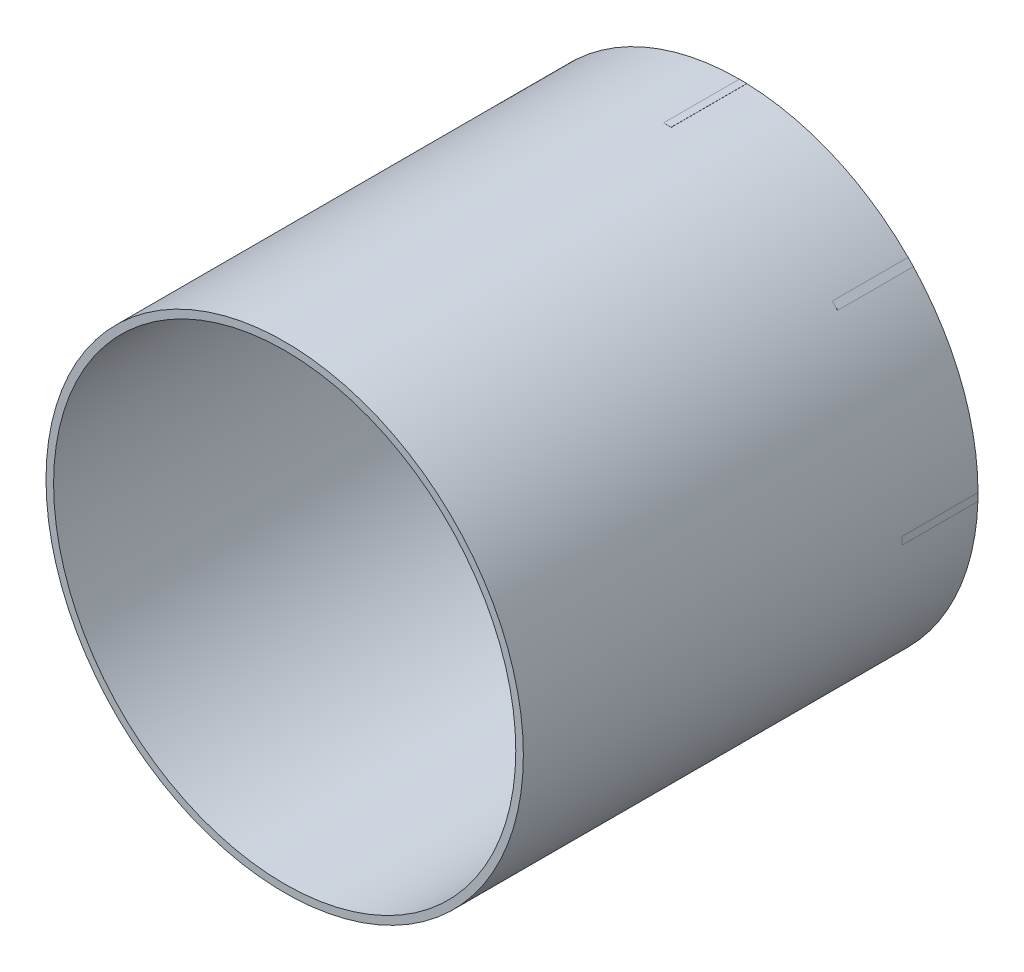
from build123d import *

# Parameters (mm, degrees)
SKETCH_1_R               = 31.5
SKETCH_1_R_2             = 30.5
EXTRUDE_1_DEPTH          = 60
SKETCH_2_W               = 31.5
SKETCH_2_H               = 1
EXTRUDE_1_2_DEPTH        = 10
PATTERN_CIRCULAR_1_COUNT = 8
SKETCH_3_R               = 12
EXTRUDE_2_DEPTH          = 3
SKETCH_4_R               = 1.6
SKETCH_4_R_2             = 5.1
CUT_EXTRUDE_1_DEPTH      = 5
PATTERN_CIRCULAR_3_COUNT = 2


with BuildPart() as part:
    # 草图1 → Extrude 1 (new body)
    with BuildSketch(Plane.XY):
        Circle(SKETCH_1_R)
        Circle(SKETCH_1_R_2, mode=Mode.SUBTRACT)
    extrude(amount=EXTRUDE_1_DEPTH)

    # 草图2 → Extrude 1 2 (add)
    with BuildSketch(Plane.XY):
        with Locations((15.75, -0.5)):
            Rectangle(SKETCH_2_W, SKETCH_2_H)
    extrude_1_2 = extrude(amount=EXTRUDE_1_2_DEPTH)

    # 阵列(圆周)1: Extrude 1 2 ×8 about axis
    pattern_circular_1_axis = Axis((0, 0, 0), (0, 0, 1))
    for i in range(1, PATTERN_CIRCULAR_1_COUNT):
        add(extrude_1_2.rotate(pattern_circular_1_axis, i * 360 / PATTERN_CIRCULAR_1_COUNT))

    # 草图3 → 凸台-拉伸2 (add)
    with BuildSketch(Plane.XY.offset(10)):
        Circle(SKETCH_3_R)
    extrude(amount=-EXTRUDE_2_DEPTH)

    # 草图4 → 切除-拉伸1 (cut)
    with BuildSketch(Plane(origin=(0, 0, 7), x_dir=(-1, 0, 0), z_dir=(0, 0, -1))):
        with Locations((-7.22609389, -3.432720072)):
            Circle(SKETCH_4_R)
        with Locations((4.076355085, -8.580986494)):
            Circle(SKETCH_4_R)
        with Locations(Location((0, 0, 0), (0, 0, 180))):
            Circle(SKETCH_4_R_2)
    cut_extrude_1 = extrude(amount=-CUT_EXTRUDE_1_DEPTH, mode=Mode.SUBTRACT)

    # 阵列(圆周)3: 切除-拉伸1 ×2 about axis
    pattern_circular_3_axis = Axis((0, 0, 0), (0, 0, 1))
    for i in range(1, PATTERN_CIRCULAR_3_COUNT):
        add(cut_extrude_1.rotate(pattern_circular_3_axis, i * 360 / PATTERN_CIRCULAR_3_COUNT), mode=Mode.SUBTRACT)


solid = part.part
